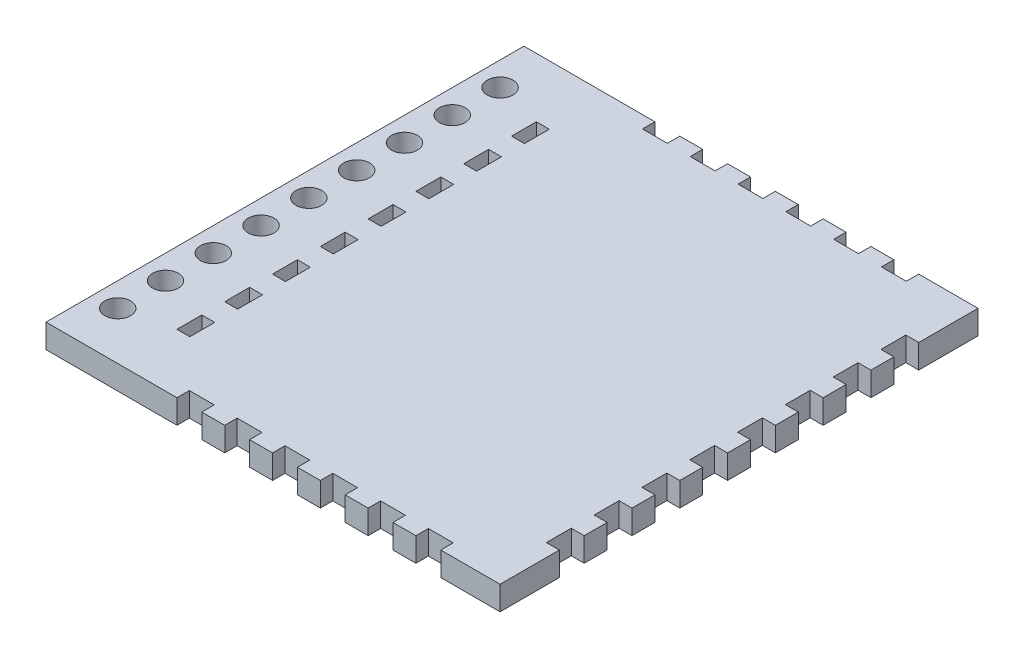
from build123d import *

# Parameters (mm, degrees)
SKETCH1_W           = 101.6
SKETCH1_H           = 127
BOSS_EXTRUDE1_DEPTH = 6.35
SKETCH2_W           = 6.604
SKETCH2_H           = 3.302
SKETCH2_W_2         = 3.429
SKETCH2_H_2         = 6.604
CUT_EXTRUDE1_DEPTH  = 82.567226875
SKETCH3_W           = 63.5
SKETCH3_H           = 127
SKETCH3_R           = 3.429
BOSS_EXTRUDE2_DEPTH = 6.35
SKETCH4_W           = 44.45
SKETCH4_H           = 127
CUT_EXTRUDE2_DEPTH  = 131.908603613


with BuildPart() as part:
    # Sketch1 → Boss-Extrude1 (new body)
    with BuildSketch(Plane(origin=(0, 0, 0), x_dir=(1, 0, 0), z_dir=(0, 1, 0))):
        Rectangle(SKETCH1_W, SKETCH1_H)
    extrude(amount=BOSS_EXTRUDE1_DEPTH)

    # Sketch2 → Cut-Extrude1 (cut, through all)
    with BuildSketch(Plane(origin=(0, 6.35, 0), x_dir=(1, 0, 0), z_dir=(0, 1, 0))):
        with Locations((-31.75, -61.849)):
            Rectangle(SKETCH2_W, SKETCH2_H)
        with Locations((-19.05, -61.849)):
            Rectangle(SKETCH2_W, SKETCH2_H)
        with Locations((-6.35, -61.849)):
            Rectangle(SKETCH2_W, SKETCH2_H)
        with Locations((6.35, -61.849)):
            Rectangle(SKETCH2_W, SKETCH2_H)
        with Locations((19.05, -61.849)):
            Rectangle(SKETCH2_W, SKETCH2_H)
        with Locations((31.75, -61.849)):
            Rectangle(SKETCH2_W, SKETCH2_H)
        with Locations((31.75, 61.849)):
            Rectangle(SKETCH2_W, SKETCH2_H)
        with Locations((19.05, 61.849)):
            Rectangle(SKETCH2_W, SKETCH2_H)
        with Locations((6.35, 61.849)):
            Rectangle(SKETCH2_W, SKETCH2_H)
        with Locations((-6.35, 61.849)):
            Rectangle(SKETCH2_W, SKETCH2_H)
        with Locations((-19.05, 61.849)):
            Rectangle(SKETCH2_W, SKETCH2_H)
        with Locations((-31.75, 61.849)):
            Rectangle(SKETCH2_W, SKETCH2_H)
        with Locations((-49.0855, 31.75)):
            Rectangle(SKETCH2_W_2, SKETCH2_H_2)
        with Locations((-49.0855, 19.05)):
            Rectangle(SKETCH2_W_2, SKETCH2_H_2)
        with Locations((-49.0855, 6.35)):
            Rectangle(SKETCH2_W_2, SKETCH2_H_2)
        with Locations((-49.0855, -6.35)):
            Rectangle(SKETCH2_W_2, SKETCH2_H_2)
        with Locations((-49.0855, -19.05)):
            Rectangle(SKETCH2_W_2, SKETCH2_H_2)
        with Locations((-49.0855, -31.75)):
            Rectangle(SKETCH2_W_2, SKETCH2_H_2)
        with Locations((49.0855, -31.75)):
            Rectangle(SKETCH2_W_2, SKETCH2_H_2)
        with Locations((49.0855, -19.05)):
            Rectangle(SKETCH2_W_2, SKETCH2_H_2)
        with Locations((49.0855, -6.35)):
            Rectangle(SKETCH2_W_2, SKETCH2_H_2)
        with Locations((49.0855, 6.35)):
            Rectangle(SKETCH2_W_2, SKETCH2_H_2)
        with Locations((49.0855, 19.05)):
            Rectangle(SKETCH2_W_2, SKETCH2_H_2)
        with Locations((49.0855, 31.75)):
            Rectangle(SKETCH2_W_2, SKETCH2_H_2)
        with Locations((-49.0855, 44.45)):
            Rectangle(SKETCH2_W_2, SKETCH2_H_2)
        with Locations((-49.0855, -44.45)):
            Rectangle(SKETCH2_W_2, SKETCH2_H_2)
        with Locations((49.0855, -44.45)):
            Rectangle(SKETCH2_W_2, SKETCH2_H_2)
        with Locations((49.0855, 44.45)):
            Rectangle(SKETCH2_W_2, SKETCH2_H_2)
    extrude(amount=-CUT_EXTRUDE1_DEPTH, mode=Mode.SUBTRACT)

    # Sketch3 → Boss-Extrude2 (add)
    with BuildSketch(Plane(origin=(0, 6.35, 0), x_dir=(1, 0, 0), z_dir=(0, 1, 0))):
        with Locations((-82.55, 0)):
            Rectangle(SKETCH3_W, SKETCH3_H)
        with Locations(Location((-101.6, 50.8, 0), (0, 0, 270))):
            Circle(SKETCH3_R, mode=Mode.SUBTRACT)
        with Locations(Location((-88.9, 50.8, 0), (0, 0, 270))):
            Circle(SKETCH3_R, mode=Mode.SUBTRACT)
        with Locations(Location((-88.9, 38.1, 0), (0, 0, 270))):
            Circle(SKETCH3_R, mode=Mode.SUBTRACT)
        with Locations(Location((-101.6, 38.1, 0), (0, 0, 270))):
            Circle(SKETCH3_R, mode=Mode.SUBTRACT)
        with Locations(Location((-101.6, 25.4, 0), (0, 0, 270))):
            Circle(SKETCH3_R, mode=Mode.SUBTRACT)
        with Locations(Location((-88.9, 25.4, 0), (0, 0, 270))):
            Circle(SKETCH3_R, mode=Mode.SUBTRACT)
        with Locations(Location((-76.2, 50.8, 0), (0, 0, 270))):
            Circle(SKETCH3_R, mode=Mode.SUBTRACT)
        with Locations(Location((-63.5, 50.8, 0), (0, 0, 270))):
            Circle(SKETCH3_R, mode=Mode.SUBTRACT)
        with Locations(Location((-76.2, 38.1, 0), (0, 0, 270))):
            Circle(SKETCH3_R, mode=Mode.SUBTRACT)
        with Locations(Location((-63.5, 38.1, 0), (0, 0, 270))):
            Circle(SKETCH3_R, mode=Mode.SUBTRACT)
        with Locations(Location((-76.2, 25.4, 0), (0, 0, 270))):
            Circle(SKETCH3_R, mode=Mode.SUBTRACT)
        with Locations(Location((-63.5, 25.4, 0), (0, 0, 270))):
            Circle(SKETCH3_R, mode=Mode.SUBTRACT)
        with Locations(Location((-101.6, 12.7, 0), (0, 0, 270))):
            Circle(SKETCH3_R, mode=Mode.SUBTRACT)
        with Locations(Location((-88.9, 12.7, 0), (0, 0, 270))):
            Circle(SKETCH3_R, mode=Mode.SUBTRACT)
        with Locations(Location((-76.2, 12.7, 0), (0, 0, 270))):
            Circle(SKETCH3_R, mode=Mode.SUBTRACT)
        with Locations(Location((-63.5, 12.7, 0), (0, 0, 270))):
            Circle(SKETCH3_R, mode=Mode.SUBTRACT)
        with Locations(Location((-101.6, 0, 0), (0, 0, 270))):
            Circle(SKETCH3_R, mode=Mode.SUBTRACT)
        with Locations(Location((-88.9, 0, 0), (0, 0, 270))):
            Circle(SKETCH3_R, mode=Mode.SUBTRACT)
        with Locations(Location((-76.2, 0, 0), (0, 0, 270))):
            Circle(SKETCH3_R, mode=Mode.SUBTRACT)
        with Locations(Location((-63.5, 0, 0), (0, 0, 270))):
            Circle(SKETCH3_R, mode=Mode.SUBTRACT)
        with Locations(Location((-101.6, -12.7, 0), (0, 0, 270))):
            Circle(SKETCH3_R, mode=Mode.SUBTRACT)
        with Locations(Location((-88.9, -12.7, 0), (0, 0, 270))):
            Circle(SKETCH3_R, mode=Mode.SUBTRACT)
        with Locations(Location((-76.2, -12.7, 0), (0, 0, 270))):
            Circle(SKETCH3_R, mode=Mode.SUBTRACT)
        with Locations(Location((-63.5, -12.7, 0), (0, 0, 270))):
            Circle(SKETCH3_R, mode=Mode.SUBTRACT)
        with Locations(Location((-101.6, -25.4, 0), (0, 0, 270))):
            Circle(SKETCH3_R, mode=Mode.SUBTRACT)
        with Locations(Location((-88.9, -25.4, 0), (0, 0, 270))):
            Circle(SKETCH3_R, mode=Mode.SUBTRACT)
        with Locations(Location((-76.2, -25.4, 0), (0, 0, 270))):
            Circle(SKETCH3_R, mode=Mode.SUBTRACT)
        with Locations(Location((-63.5, -25.4, 0), (0, 0, 270))):
            Circle(SKETCH3_R, mode=Mode.SUBTRACT)
        with Locations(Location((-101.6, -38.1, 0), (0, 0, 270))):
            Circle(SKETCH3_R, mode=Mode.SUBTRACT)
        with Locations(Location((-88.9, -38.1, 0), (0, 0, 270))):
            Circle(SKETCH3_R, mode=Mode.SUBTRACT)
        with Locations(Location((-76.2, -38.1, 0), (0, 0, 270))):
            Circle(SKETCH3_R, mode=Mode.SUBTRACT)
        with Locations(Location((-63.5, -38.1, 0), (0, 0, 270))):
            Circle(SKETCH3_R, mode=Mode.SUBTRACT)
        with Locations(Location((-101.6, -50.8, 0), (0, 0, 270))):
            Circle(SKETCH3_R, mode=Mode.SUBTRACT)
        with Locations(Location((-88.9, -50.8, 0), (0, 0, 270))):
            Circle(SKETCH3_R, mode=Mode.SUBTRACT)
        with Locations(Location((-76.2, -50.8, 0), (0, 0, 270))):
            Circle(SKETCH3_R, mode=Mode.SUBTRACT)
        with Locations(Location((-63.5, -50.8, 0), (0, 0, 270))):
            Circle(SKETCH3_R, mode=Mode.SUBTRACT)
    extrude(amount=-BOSS_EXTRUDE2_DEPTH)

    # Sketch4 → Cut-Extrude2 (cut, through all)
    with BuildSketch(Plane(origin=(0, 6.35, 0), x_dir=(1, 0, 0), z_dir=(0, 1, 0))):
        with Locations((-92.075, 0)):
            Rectangle(SKETCH4_W, SKETCH4_H)
    extrude(amount=-CUT_EXTRUDE2_DEPTH, mode=Mode.SUBTRACT)


solid = part.part
